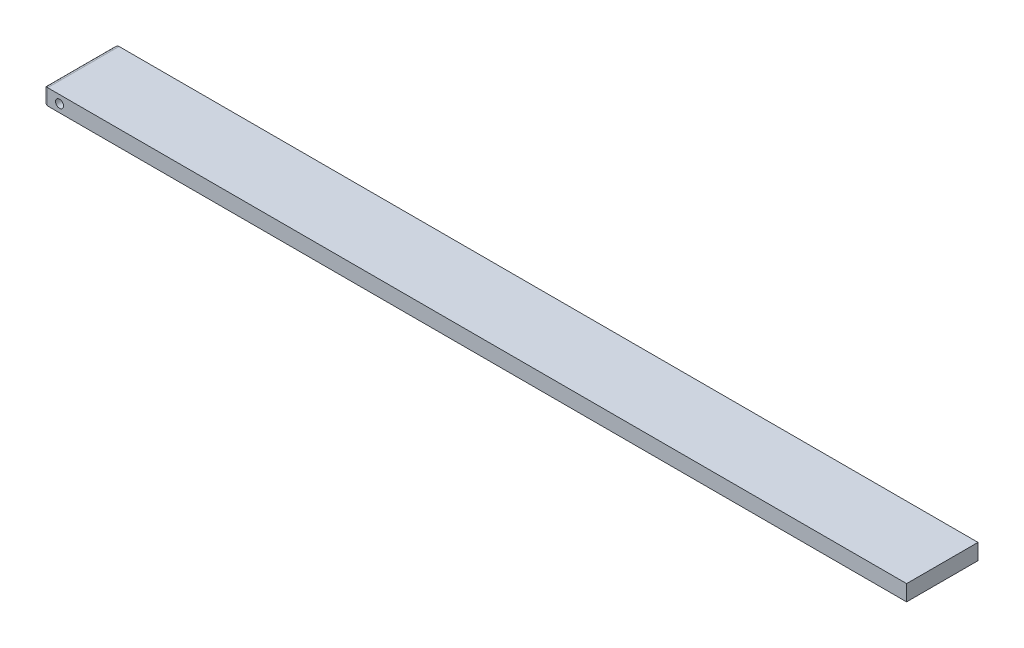
from build123d import *

# Parameters (mm, degrees)
SKETCH1_W           = 51
SKETCH1_H           = 2
SKETCH1_R           = 0.5
BOSS_EXTRUDE1_DEPTH = 9
FILLET2_R           = 0.5
SKETCH2_W           = 9
SKETCH2_H           = 2
BOSS_EXTRUDE2_DEPTH = 5
SCALE1_SCALE        = 1.9329
SCALE2_SCALE        = 1.5
SKETCH4_W           = 26.09415
SKETCH4_H           = 5.7987
BOSS_EXTRUDE3_DEPTH = 130
SKETCH5_W           = 26.09415
SKETCH5_H           = 5.7987
BOSS_EXTRUDE4_DEPTH = 23


with BuildPart() as part:
    # Sketch1 → Boss-Extrude1 (new body)
    with BuildSketch(Plane.XY):
        with Locations((-5.433877133, 0.085743345)):
            Rectangle(SKETCH1_W, SKETCH1_H)
        with Locations((-28.933877133, 0.085743345)):
            Circle(SKETCH1_R, mode=Mode.SUBTRACT)
    extrude(amount=BOSS_EXTRUDE1_DEPTH)

    # Fillet2
    fillet2_edges = [part.edges().sort_by_distance(p)[0] for p in [
        (-30.933877133, 0.085743345, 9),
        (-30.933877133, 0.085743345, 0),
        (-30.933877133, 1.085743345, 4.5),
        (-30.933877133, -0.914256655, 4.5),
    ]]
    fillet(fillet2_edges, radius=FILLET2_R)

    # Sketch2 → Boss-Extrude2 (add)
    with BuildSketch(Plane(origin=(20.066122867, 0, 0), x_dir=(0, 0, -1), z_dir=(1, 0, 0))):
        with Locations((-4.5, 0.085743345)):
            Rectangle(SKETCH2_W, SKETCH2_H)
    extrude(amount=BOSS_EXTRUDE2_DEPTH)


with BuildPart() as part_1:
    # Scale1: scaled about (-2.718472865, 0.085743345, 4.5)
    add(part.part.scale(SCALE1_SCALE).moved(Location((2.536063336, -0.079989967, -4.19805))))


with BuildPart() as part_2:
    # Scale2: scaled about (-2.718472864, 0.085743345, 4.5)
    add(part_1.part.scale(SCALE2_SCALE).moved(Location((1.359236432, -0.042871672, -2.25))))

    # Sketch4 → Boss-Extrude3 (add)
    with BuildSketch(Plane(origin=(77.83872718, 0, 0), x_dir=(0, 0, -1), z_dir=(1, 0, 0))):
        with Locations((-4.500001066, 0.085744554)):
            Rectangle(SKETCH4_W, SKETCH4_H)
    extrude(amount=BOSS_EXTRUDE3_DEPTH)

    # Sketch5 → Boss-Extrude4 (add)
    with BuildSketch(Plane(origin=(207.83872718, 0, 0), x_dir=(0, 0, -1), z_dir=(1, 0, 0))):
        with Locations((-4.500001066, 0.085744554)):
            Rectangle(SKETCH5_W, SKETCH5_H)
    extrude(amount=BOSS_EXTRUDE4_DEPTH)


solid = part_2.part
